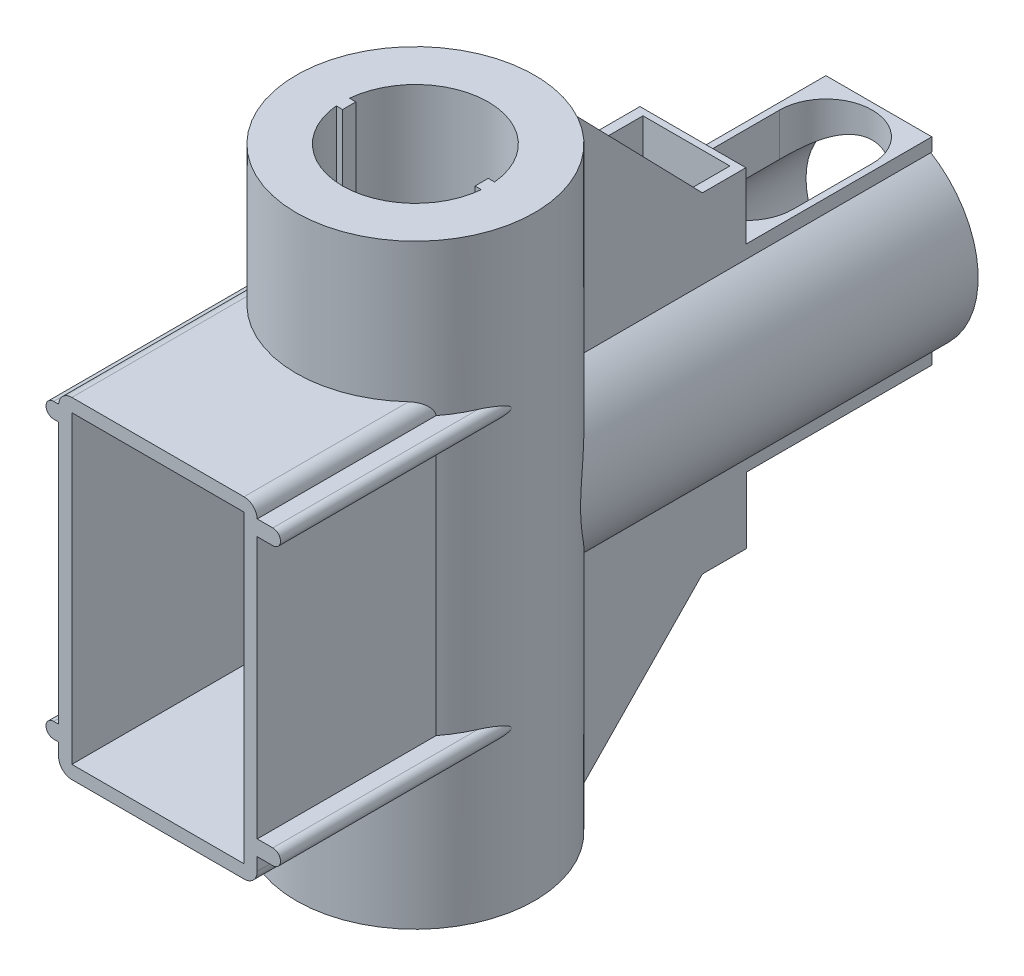
from build123d import *

# Parameters (mm, degrees)
SKETCH1_R                 = 7.5
BOSS_EXTRUDE1_DEPTH       = 33
SKETCH2_R                 = 5.5
CUT_EXTRUDE1_DEPTH        = 25
BOSS_EXTRUDE9_DEPTH       = 22.5
BOSS_EXTRUDE9_DEPTH_BACK  = 22.5
SKETCH9_R                 = 9
BOSS_EXTRUDE10_DEPTH      = 17.5
BOSS_EXTRUDE11_DEPTH      = 17.5
SKETCH16_W                = 8
SKETCH16_H                = 6
BOSS_EXTRUDE12_DEPTH      = 29.5
BOSS_EXTRUDE13_DEPTH      = 4
MIRROR11_COPY_1_DEPTH     = 17.5
MIRROR11_COPY_2_DEPTH     = 17.5
CUT_EXTRUDE4_DEPTH        = 15
CUT_EXTRUDE4_DEPTH_BACK   = 14
SKETCH10_R                = 5.5
CUT_EXTRUDE5_DEPTH        = 50
SKETCH22_W                = 13
SKETCH22_H                = 23
CUT_EXTRUDE6_DEPTH        = 18
CUT_EXTRUDE7_DEPTH        = 42
CUT_EXTRUDE7_DEPTH_BACK   = 29
SKETCH23_W                = 6.565675544
SKETCH23_H                = 10.807260143
BOSS_EXTRUDE14_DEPTH      = 1
BOSS_EXTRUDE14_DEPTH_BACK = 1
SKETCH26_W                = 8
SKETCH26_H                = 14.08721253
CUT_EXTRUDE8_DEPTH        = 5
SKETCH27_W                = 8
SKETCH27_H                = 14
CUT_EXTRUDE9_DEPTH        = 5
SKETCH29_W                = 1
SKETCH29_H                = 1
BOSS_EXTRUDE15_DEPTH      = 45


with BuildPart() as part:
    # Sketch1 → Boss-Extrude1 (new body)
    with BuildSketch(Plane.XY):
        Circle(SKETCH1_R)
    extrude(amount=BOSS_EXTRUDE1_DEPTH)

    # Sketch2 → Cut-Extrude1 (cut)
    with BuildSketch(Plane(origin=(0, 0, 0), x_dir=(-1, 0, 0), z_dir=(0, 0, -1))):
        Circle(SKETCH2_R)
    extrude(amount=-CUT_EXTRUDE1_DEPTH, mode=Mode.SUBTRACT)


with BuildPart() as body_2:
    # Sketch9 → Boss-Extrude9 (new, two sides: drawn at the far end of the back side and taken through both)
    with BuildSketch(Plane(origin=(0, 0, 0), x_dir=(1, 0, 0), z_dir=(0, 1, 0)).offset(-BOSS_EXTRUDE9_DEPTH_BACK)):
        with Locations((0, -35)):
            Circle(SKETCH9_R)
    extrude(amount=BOSS_EXTRUDE9_DEPTH + BOSS_EXTRUDE9_DEPTH_BACK)

    # Sketch11 → Boss-Extrude10 (add)
    with BuildSketch(Plane.XY.offset(54.041927483)):
        with BuildLine():
            Line((-6.901940918, 11.993265391), (6.098059082, 11.993265391))
            ThreePointArc((6.098059082, 11.993265391), (6.805165863, 11.700372172), (7.098059082, 10.993265391))
            Line((7.098059082, 10.993265391), (7.098059082, -12.006734609))
            ThreePointArc((7.098059082, -12.006734609), (6.805165863, -12.71384139), (6.098059082, -13.006734609))
            Line((6.098059082, -13.006734609), (-6.901940918, -13.006734609))
            ThreePointArc((-6.901940918, -13.006734609), (-7.609047699, -12.71384139), (-7.901940918, -12.006734609))
            Line((-7.901940918, -12.006734609), (-7.901940918, 10.993265391))
            ThreePointArc((-7.901940918, 10.993265391), (-7.609047699, 11.700372172), (-6.901940918, 11.993265391))
        make_face()
    extrude(amount=-BOSS_EXTRUDE10_DEPTH)

    # Sketch12 → Boss-Extrude11 (add)
    with BuildSketch(Plane.XY.offset(54.041927483)):
        with BuildLine():
            Line((7.098059082, 11.045192636), (8.273377109, 11.045192636))
            ThreePointArc((8.273377109, 11.045192636), (8.855145996, 10.463423748), (8.273377109, 9.881654861))
            Line((8.273377109, 9.881654861), (7.098059082, 9.881654861))
            ThreePointArc((7.098059082, 9.881654861), (6.516290194, 10.463423748), (7.098059082, 11.045192636))
        make_face()
    boss_extrude11 = extrude(amount=-BOSS_EXTRUDE11_DEPTH)

    # Sketch16 → Boss-Extrude12 (add)
    with BuildSketch(Plane.XY):
        with Locations((0, 9.466755176)):
            Rectangle(SKETCH16_W, SKETCH16_H)
    boss_extrude12 = extrude(amount=BOSS_EXTRUDE12_DEPTH)

    # Sketch20 → Boss-Extrude13 (add, symmetric)
    with BuildSketch(Plane(origin=(0, 0, 0), x_dir=(0, 0, -1), z_dir=(1, 0, 0))):
        Polygon((-27.090892422, 22.5), (-26.937742252, 12.466755176), (-17.326979359, 12.466755176), align=None)
    boss_extrude13 = extrude(amount=BOSS_EXTRUDE13_DEPTH, both=True)

    # Mirror9: Boss-Extrude12, Boss-Extrude13 across plane
    add(boss_extrude12.mirror(Plane.ZX))
    add(boss_extrude13.mirror(Plane.ZX))

    # Mirror10: Boss-Extrude11 across plane
    add(boss_extrude11.mirror(Plane.ZX))

    # Mirror11 copy 1 sketch → Mirror11 copy 1 (add)
    with BuildSketch(Plane(origin=(0, 0, 54.041927483), x_dir=(-1, 0, 0), z_dir=(0, 0, 1))):
        with BuildLine():
            Line((7.098059082, 11.045192636), (8.273377109, 11.045192636))
            ThreePointArc((8.273377109, 11.045192636), (8.855145996, 10.463423748), (8.273377109, 9.881654861))
            Line((8.273377109, 9.881654861), (7.098059082, 9.881654861))
            ThreePointArc((7.098059082, 9.881654861), (6.516290194, 10.463423748), (7.098059082, 11.045192636))
        make_face()
    extrude(amount=-MIRROR11_COPY_1_DEPTH)

    # Mirror11 copy 2 sketch → Mirror11 copy 2 (add)
    with BuildSketch(Plane(origin=(0, 0, 54.041927483), x_dir=(-1, 0, 0), z_dir=(0, 0, 1))):
        with BuildLine():
            Line((7.098059082, -11.045192636), (8.273377109, -11.045192636))
            ThreePointArc((8.273377109, -11.045192636), (8.855145996, -10.463423748), (8.273377109, -9.881654861))
            Line((8.273377109, -9.881654861), (7.098059082, -9.881654861))
            ThreePointArc((7.098059082, -9.881654861), (6.516290194, -10.463423748), (7.098059082, -11.045192636))
        make_face()
    extrude(amount=-MIRROR11_COPY_2_DEPTH)


with BuildPart() as cut_extrude4_tool:
    # Sketch4 → Cut-Extrude4 (new, two sides: drawn at the far end of the back side and taken through both)
    with BuildSketch(Plane(origin=(0, 0, 0), x_dir=(1, 0, 0), z_dir=(0, 1, 0)).offset(-CUT_EXTRUDE4_DEPTH_BACK)):
        with BuildLine():
            Line((-3.5, -10), (-3.5, -4))
            ThreePointArc((-3.5, -4), (0, -0.5), (3.5, -4))
            Line((3.5, -4), (3.5, -10))
            ThreePointArc((3.5, -10), (0, -13.5), (-3.5, -10))
        make_face()
    extrude(amount=CUT_EXTRUDE4_DEPTH + CUT_EXTRUDE4_DEPTH_BACK)


with BuildPart() as part_1:
    add(part.part)

    # Cut-Extrude4: cut by cut_extrude4_tool
    add(cut_extrude4_tool.part, mode=Mode.SUBTRACT)


with BuildPart() as body_2_1:
    add(body_2.part)

    # Cut-Extrude4: cut by cut_extrude4_tool
    add(cut_extrude4_tool.part, mode=Mode.SUBTRACT)


with BuildPart() as cut_extrude5_tool:
    # Sketch10 → Cut-Extrude5 (new body)
    with BuildSketch(Plane(origin=(0, 22.5, 0), x_dir=(1, 0, 0), z_dir=(0, 1, 0))):
        with Locations((0, -35)):
            Circle(SKETCH10_R)
    extrude(amount=-CUT_EXTRUDE5_DEPTH)


with BuildPart() as part_2:
    add(part_1.part)

    # Cut-Extrude5: cut by cut_extrude5_tool
    add(cut_extrude5_tool.part, mode=Mode.SUBTRACT)


with BuildPart() as body_2_2:
    add(body_2_1.part)

    # Cut-Extrude5: cut by cut_extrude5_tool
    add(cut_extrude5_tool.part, mode=Mode.SUBTRACT)

    # Sketch22 → Cut-Extrude6 (cut)
    with BuildSketch(Plane.XY.offset(54.041927483)):
        with Locations((-0.401940918, -0.506734609)):
            Rectangle(SKETCH22_W, SKETCH22_H)
    extrude(amount=-CUT_EXTRUDE6_DEPTH, mode=Mode.SUBTRACT)


with BuildPart() as cut_extrude7_tool:
    # Sketch23 → Cut-Extrude7 (new, two sides: drawn at the far end of the back side and taken through both)
    with BuildSketch(Plane(origin=(0, 0, 0), x_dir=(1, 0, 0), z_dir=(0, 1, 0)).offset(-CUT_EXTRUDE7_DEPTH_BACK)):
        with Locations((0, -19.937742252)):
            Rectangle(SKETCH23_W, SKETCH23_H)
    extrude(amount=CUT_EXTRUDE7_DEPTH + CUT_EXTRUDE7_DEPTH_BACK)


with BuildPart() as part_3:
    add(part_2.part)

    # Cut-Extrude7: cut by cut_extrude7_tool
    add(cut_extrude7_tool.part, mode=Mode.SUBTRACT)



with BuildPart() as body_2_3:
    add(body_2_2.part)

    # Cut-Extrude7: cut by cut_extrude7_tool
    add(cut_extrude7_tool.part, mode=Mode.SUBTRACT)


with BuildPart() as part_4:
    add(part_3.part)

    add(body_2_3.part)  # Boss-Extrude14 merges body 2
    # Sketch24 → Boss-Extrude14 (add, two sides: drawn at the far end of the back side and taken through both)
    with BuildSketch(Plane(origin=(0, 0, 0), x_dir=(1, 0, 0), z_dir=(0, 1, 0)).offset(-BOSS_EXTRUDE14_DEPTH_BACK)):
        with BuildLine():
            Line((-7.5, -13.102416079), (-15.5, -13.102416079))
            ThreePointArc((-15.5, -13.102416079), (-16.207106781, -12.80952286), (-16.5, -12.102416079))
            Line((-16.5, -12.102416079), (-16.5, -7.102416079))
            ThreePointArc((-16.5, -7.102416079), (-16.207106781, -6.395309297), (-15.5, -6.102416079))
            Line((-15.5, -6.102416079), (-7.5, -6.102416079))
            Line((-7.5, -6.102416079), (-7.5, -13.102416079))
        make_face()
    extrude(amount=BOSS_EXTRUDE14_DEPTH + BOSS_EXTRUDE14_DEPTH_BACK)

    # Sketch26 → Cut-Extrude8 (cut)
    with BuildSketch(Plane(origin=(0, 12.466755176, 0), x_dir=(1, 0, 0), z_dir=(0, 1, 0))):
        with Locations((0, -7)):
            Rectangle(SKETCH26_W, SKETCH26_H)
    extrude(amount=-CUT_EXTRUDE8_DEPTH, mode=Mode.SUBTRACT)

    # Sketch27 → Cut-Extrude9 (cut)
    with BuildSketch(Plane.XZ.offset(12.466755176)):
        with Locations((0, 7)):
            Rectangle(SKETCH27_W, SKETCH27_H)
    extrude(amount=-CUT_EXTRUDE9_DEPTH, mode=Mode.SUBTRACT)

    # Sketch29 → Boss-Extrude15 (add)
    with BuildSketch(Plane.XZ.offset(22.5)):
        with Locations((-5.5, 35)):
            Rectangle(SKETCH29_W, SKETCH29_H)
        with Locations((5.5, 35)):
            Rectangle(SKETCH29_W, SKETCH29_H)
    extrude(amount=-BOSS_EXTRUDE15_DEPTH)


solid = part_4.part
